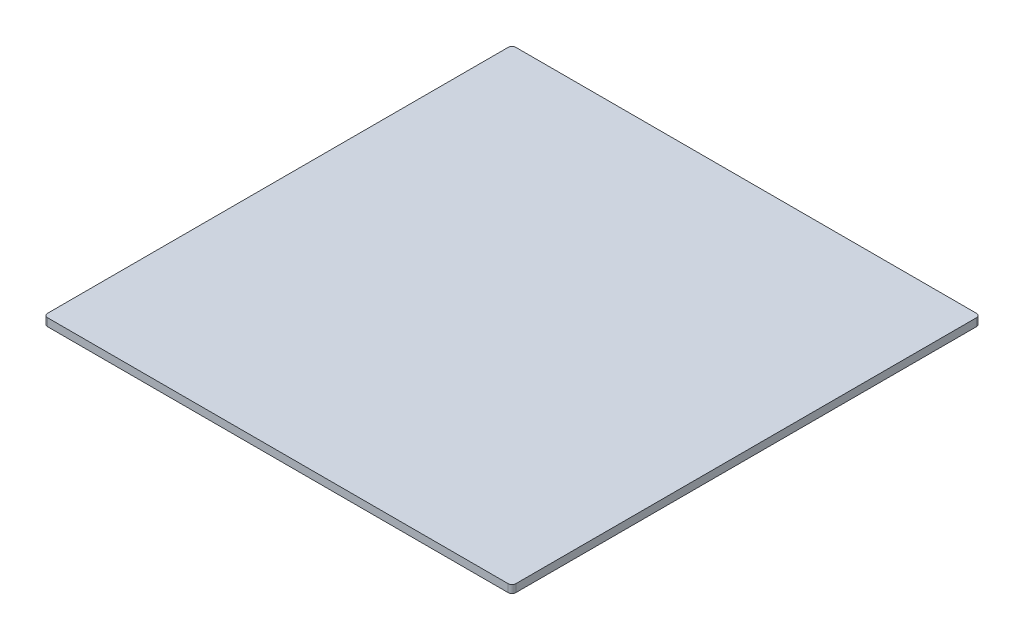
from build123d import *

# Parameters (mm, degrees)
RESSALTO_EXTRUS_O1_DEPTH = 2


with BuildPart() as part:
    # Esboço1 → Ressalto-extrusão1 (new body)
    with BuildSketch(Plane(origin=(0, 0, 0), x_dir=(1, 0, 0), z_dir=(0, 1, 0))):
        with BuildLine():
            Line((-26.702808043, 178.616125956), (91.297191957, 178.616125956))
            ThreePointArc((91.297191957, 178.616125956), (92.004298738, 178.323232737), (92.297191957, 177.616125956))
            Line((92.297191957, 177.616125956), (92.297191957, 59.616125956))
            ThreePointArc((92.297191957, 59.616125956), (92.004298738, 58.909019175), (91.297191957, 58.616125956))
            Line((91.297191957, 58.616125956), (-26.702808043, 58.616125956))
            ThreePointArc((-26.702808043, 58.616125956), (-27.409914824, 58.909019175), (-27.702808043, 59.616125956))
            Line((-27.702808043, 59.616125956), (-27.702808043, 177.616125956))
            ThreePointArc((-27.702808043, 177.616125956), (-27.409914824, 178.323232737), (-26.702808043, 178.616125956))
        make_face()
    extrude(amount=RESSALTO_EXTRUS_O1_DEPTH)


solid = part.part
